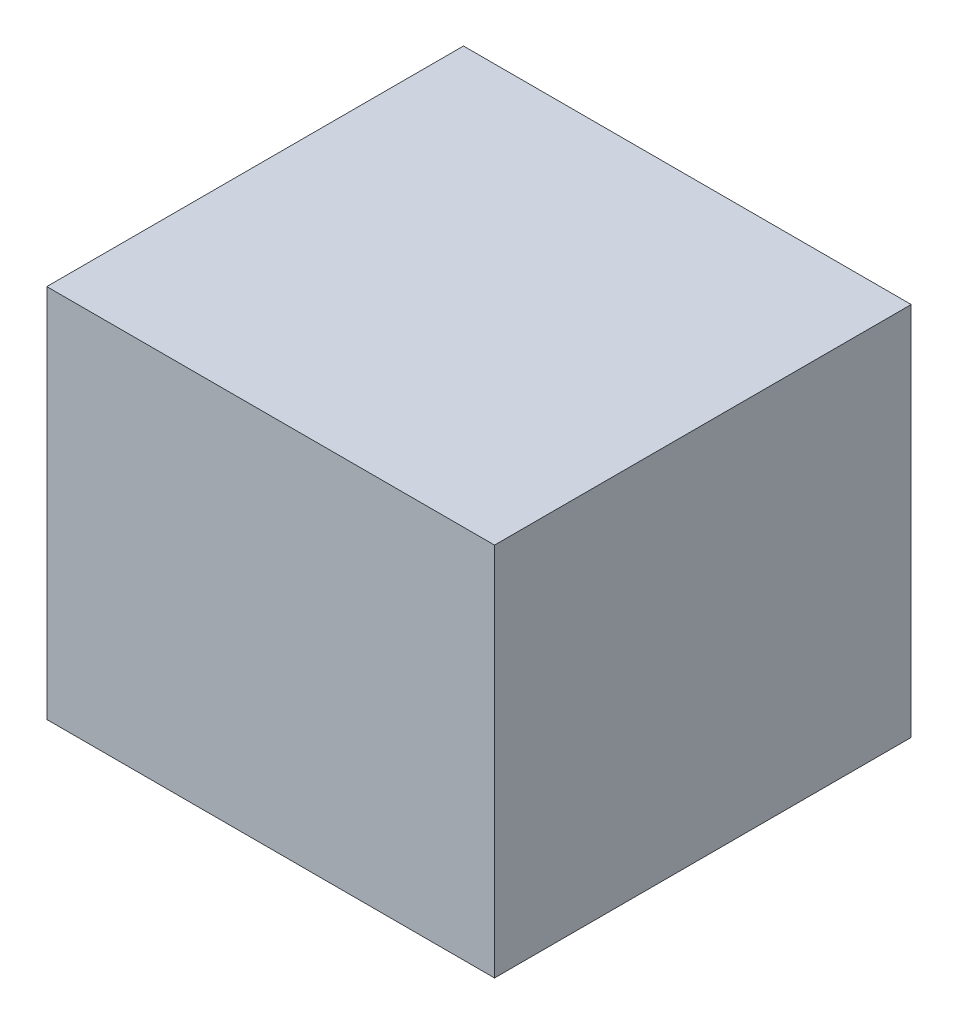
from build123d import *

# Parameters (mm, degrees)
SKETCH1_W           = 38.9
SKETCH1_H           = 35
BOSS_EXTRUDE1_DEPTH = 41.8


with BuildPart() as part:
    # Sketch1 → Boss-Extrude1 (new body)
    with BuildSketch(Plane(origin=(0, 0, 0), x_dir=(0, 0, -1), z_dir=(1, 0, 0))):
        Rectangle(SKETCH1_W, SKETCH1_H)
    extrude(amount=BOSS_EXTRUDE1_DEPTH)


solid = part.part
